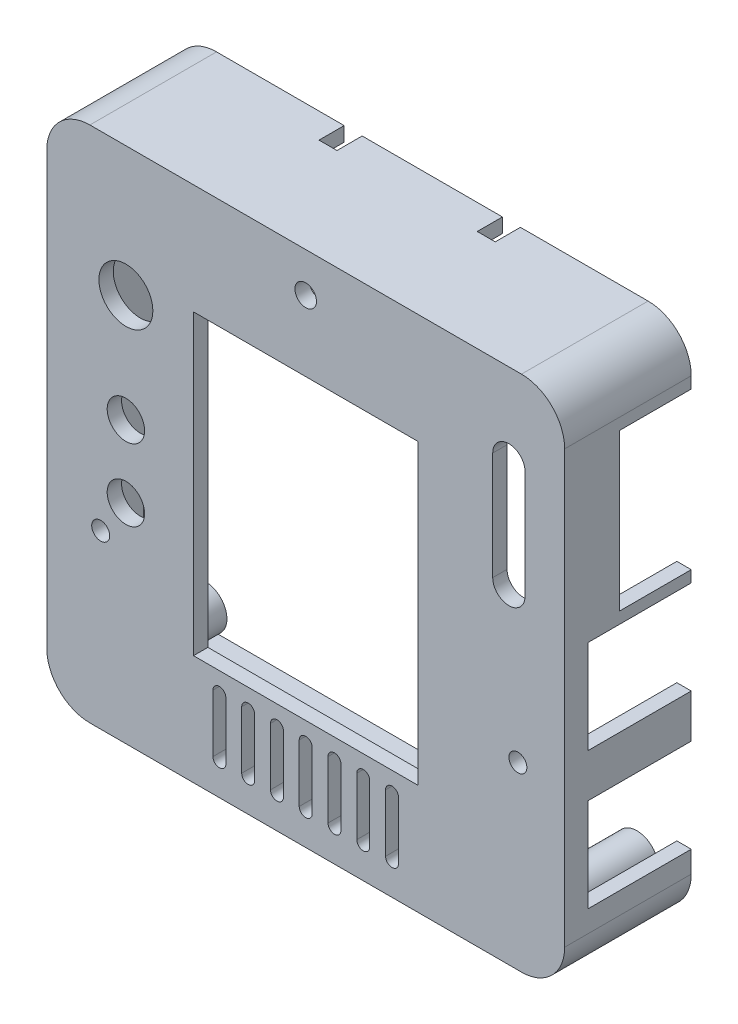
from build123d import *

# Parameters (mm, degrees)
BOSS_EXTRUDE1_DEPTH = 17.6
CUT_EXTRUDE1_DEPTH  = 15.6
SKETCH3_R           = 3
SKETCH3_R_2         = 2.5
BOSS_EXTRUDE2_DEPTH = 14.05
SKETCH4_W           = 6
SKETCH4_H           = 2.3
CUT_EXTRUDE2_DEPTH  = 14.05
SKETCH5_R           = 1.1
CUT_EXTRUDE3_DEPTH  = 12
SKETCH6_R           = 3.75
SKETCH6_R_2         = 2.6
SKETCH6_R_3         = 1.5
SKETCH6_R_4         = 1.25
SKETCH6_W           = 31.2
SKETCH6_H           = 41.4
CUT_EXTRUDE4_DEPTH  = 2
SKETCH7_W           = 3.5
SKETCH7_H           = 13.01
CUT_EXTRUDE5_DEPTH  = 14.35
SKETCH8_W           = 3.5
SKETCH8_H           = 21.74
CUT_EXTRUDE6_DEPTH  = 10
SKETCH9_W           = 3.5
SKETCH9_H           = 12.6
CUT_EXTRUDE7_DEPTH  = 6.135
SKETCH10_W          = 2.5
SKETCH10_H          = 3.5
CUT_EXTRUDE8_DEPTH  = 3.5


with BuildPart() as part:
    # Sketch1 → Boss-Extrude1 (new body)
    with BuildSketch(Plane.XY):
        with BuildLine():
            Line((-30, -36), (30, -36))
            ThreePointArc((30, -36), (34.242640687, -34.242640687), (36, -30))
            Line((36, -30), (36, 30))
            ThreePointArc((36, 30), (34.242640687, 34.242640687), (30, 36))
            Line((30, 36), (-30, 36))
            ThreePointArc((-30, 36), (-34.242640687, 34.242640687), (-36, 30))
            Line((-36, 30), (-36, -30))
            ThreePointArc((-36, -30), (-34.242640687, -34.242640687), (-30, -36))
        make_face()
    extrude(amount=BOSS_EXTRUDE1_DEPTH)

    # Sketch2 → Cut-Extrude1 (cut)
    with BuildSketch(Plane.XY):
        with BuildLine():
            Line((-30, -34), (30, -34))
            ThreePointArc((30, -34), (32.828427125, -32.828427125), (34, -30))
            Line((34, -30), (34, 30))
            ThreePointArc((34, 30), (32.828427125, 32.828427125), (30, 34))
            Line((30, 34), (-30, 34))
            ThreePointArc((-30, 34), (-32.828427125, 32.828427125), (-34, 30))
            Line((-34, 30), (-34, -30))
            ThreePointArc((-34, -30), (-32.828427125, -32.828427125), (-30, -34))
        make_face()
    extrude(amount=CUT_EXTRUDE1_DEPTH, mode=Mode.SUBTRACT)

    # Sketch3 → Boss-Extrude2 (add)
    with BuildSketch(Plane.XY.offset(1.55)):
        with Locations(Location((-30, 30, 0), (0, 0, 180))):
            Circle(SKETCH3_R)
        with Locations(Location((30, 30, 0), (0, 0, 180))):
            Circle(SKETCH3_R_2)
        with Locations(Location((-30, -30, 0), (0, 0, 180))):
            Circle(SKETCH3_R)
        with Locations(Location((30, -30, 0), (0, 0, 180))):
            Circle(SKETCH3_R)
    extrude(amount=BOSS_EXTRUDE2_DEPTH)

    # Sketch4 → Cut-Extrude2 (cut)
    with BuildSketch(Plane.XY.offset(1.55)):
        with Locations((30, 27.15)):
            Rectangle(SKETCH4_W, SKETCH4_H)
    extrude(amount=CUT_EXTRUDE2_DEPTH, mode=Mode.SUBTRACT)

    # Sketch5 → Cut-Extrude3 (cut)
    with BuildSketch(Plane.XY.offset(1.55)):
        with Locations((-30, 30)):
            Circle(SKETCH5_R)
        with Locations((30, 30)):
            Circle(SKETCH5_R)
        with Locations((-30, -30)):
            Circle(SKETCH5_R)
        with Locations((30, -30)):
            Circle(SKETCH5_R)
    extrude(amount=CUT_EXTRUDE3_DEPTH, mode=Mode.SUBTRACT)

    # Sketch6 → Cut-Extrude4 (cut)
    with BuildSketch(Plane.XY.offset(15.6)):
        with Locations((-25, 18)):
            Circle(SKETCH6_R)
        with Locations((-25, 3)):
            Circle(SKETCH6_R_2)
        with Locations((-25, -7)):
            Circle(SKETCH6_R_2)
        with Locations((0, 30.5)):
            Circle(SKETCH6_R_3)
        with Locations((-28.5, -12.1)):
            Circle(SKETCH6_R_4)
        with Locations((29.5, -11)):
            Circle(SKETCH6_R_4)
        Rectangle(SKETCH6_W, SKETCH6_H)
        with BuildLine():
            Line((30.5, 24.5), (30.5, 9.5))
            ThreePointArc((30.5, 9.5), (28.25, 7.25), (26, 9.5))
            Line((26, 9.5), (26, 24.5))
            ThreePointArc((26, 24.5), (28.25, 26.75), (30.5, 24.5))
        make_face()
        with BuildLine():
            Line((-11.1, -23.5), (-11.1, -31.5))
            ThreePointArc((-11.1, -31.5), (-12, -32.4), (-12.9, -31.5))
            Line((-12.9, -31.5), (-12.9, -23.5))
            ThreePointArc((-12.9, -23.5), (-12, -22.6), (-11.1, -23.5))
        make_face()
        with BuildLine():
            Line((-7.1, -23.5), (-7.1, -31.5))
            ThreePointArc((-7.1, -31.5), (-8, -32.4), (-8.9, -31.5))
            Line((-8.9, -31.5), (-8.9, -23.5))
            ThreePointArc((-8.9, -23.5), (-8, -22.6), (-7.1, -23.5))
        make_face()
        with BuildLine():
            Line((-3.1, -23.5), (-3.1, -31.5))
            ThreePointArc((-3.1, -31.5), (-4, -32.4), (-4.9, -31.5))
            Line((-4.9, -31.5), (-4.9, -23.5))
            ThreePointArc((-4.9, -23.5), (-4, -22.6), (-3.1, -23.5))
        make_face()
        with BuildLine():
            Line((0.9, -23.5), (0.9, -31.5))
            ThreePointArc((0.9, -31.5), (0, -32.4), (-0.9, -31.5))
            Line((-0.9, -31.5), (-0.9, -23.5))
            ThreePointArc((-0.9, -23.5), (0, -22.6), (0.9, -23.5))
        make_face()
        with BuildLine():
            Line((4.9, -23.5), (4.9, -31.5))
            ThreePointArc((4.9, -31.5), (4, -32.4), (3.1, -31.5))
            Line((3.1, -31.5), (3.1, -23.5))
            ThreePointArc((3.1, -23.5), (4, -22.6), (4.9, -23.5))
        make_face()
        with BuildLine():
            Line((8.9, -23.5), (8.9, -31.5))
            ThreePointArc((8.9, -31.5), (8, -32.4), (7.1, -31.5))
            Line((7.1, -31.5), (7.1, -23.5))
            ThreePointArc((7.1, -23.5), (8, -22.6), (8.9, -23.5))
        make_face()
        with BuildLine():
            Line((12.9, -23.5), (12.9, -31.5))
            ThreePointArc((12.9, -31.5), (12, -32.4), (11.1, -31.5))
            Line((11.1, -31.5), (11.1, -23.5))
            ThreePointArc((11.1, -23.5), (12, -22.6), (12.9, -23.5))
        make_face()
    extrude(amount=CUT_EXTRUDE4_DEPTH, mode=Mode.SUBTRACT)

    # Sketch7 → Cut-Extrude5 (cut)
    with BuildSketch(Plane.XY):
        with Locations((35.25, -1.445)):
            Rectangle(SKETCH7_W, SKETCH7_H)
        with Locations((35.25, -20.495)):
            Rectangle(SKETCH7_W, SKETCH7_H)
    extrude(amount=CUT_EXTRUDE5_DEPTH, mode=Mode.SUBTRACT)

    # Sketch8 → Cut-Extrude6 (cut)
    with BuildSketch(Plane.XY):
        with Locations((35.25, 17.53)):
            Rectangle(SKETCH8_W, SKETCH8_H)
    extrude(amount=CUT_EXTRUDE6_DEPTH, mode=Mode.SUBTRACT)

    # Sketch9 → Cut-Extrude7 (cut)
    with BuildSketch(Plane.XY):
        with Locations((-35.25, -19)):
            Rectangle(SKETCH9_W, SKETCH9_H)
    extrude(amount=CUT_EXTRUDE7_DEPTH, mode=Mode.SUBTRACT)

    # Sketch10 → Cut-Extrude8 (cut)
    with BuildSketch(Plane.XY):
        with Locations((-11, 35.25)):
            Rectangle(SKETCH10_W, SKETCH10_H)
        with Locations((11, 35.25)):
            Rectangle(SKETCH10_W, SKETCH10_H)
    extrude(amount=CUT_EXTRUDE8_DEPTH, mode=Mode.SUBTRACT)


solid = part.part
